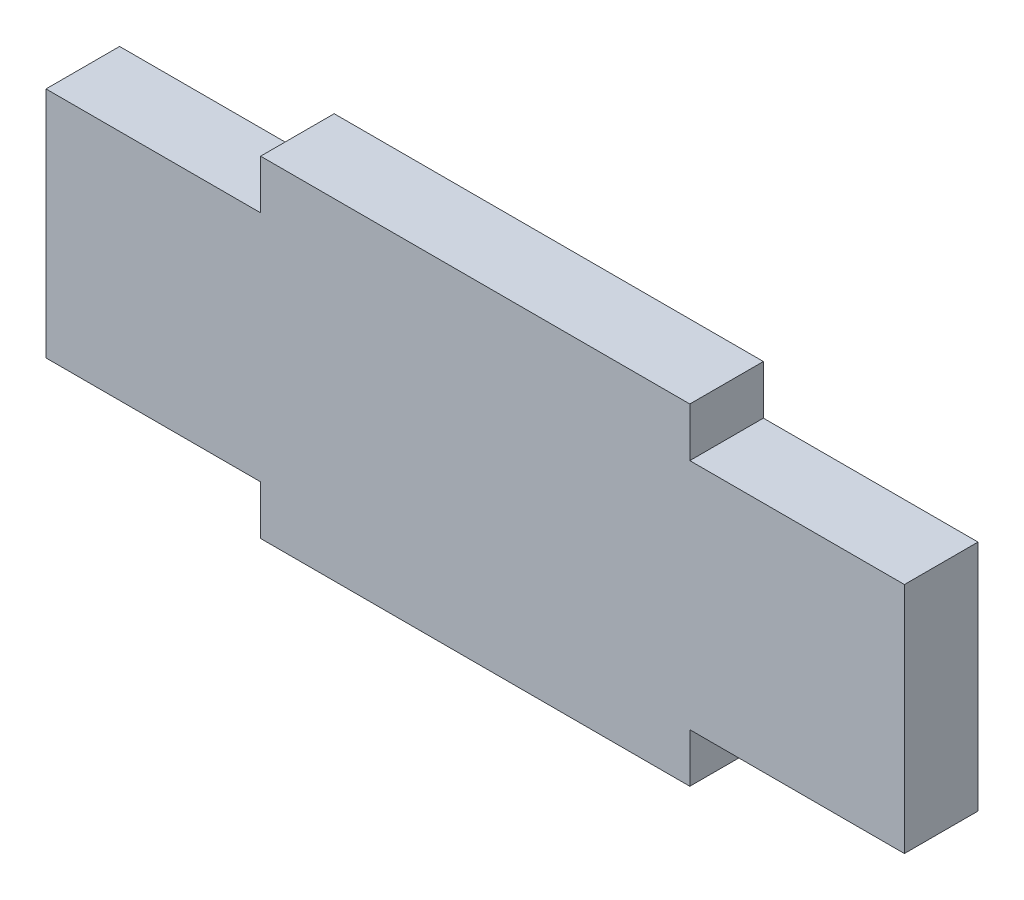
from build123d import *

# Parameters (mm, degrees)
ESBO_O1_W                = 70
ESBO_O1_H                = 19
ESBO_O1_W_2              = 35
ESBO_O1_H_2              = 4
RESSALTO_EXTRUS_O1_DEPTH = 6


with BuildPart() as part:
    # Esboço1 → Ressalto-extrusão1 (new body)
    with BuildSketch(Plane.XY):
        Rectangle(ESBO_O1_W, ESBO_O1_H)
        with Locations((0, 11.5)):
            Rectangle(ESBO_O1_W_2, ESBO_O1_H_2)
        with Locations((0, -11.5)):
            Rectangle(ESBO_O1_W_2, ESBO_O1_H_2)
    extrude(amount=RESSALTO_EXTRUS_O1_DEPTH)


solid = part.part
